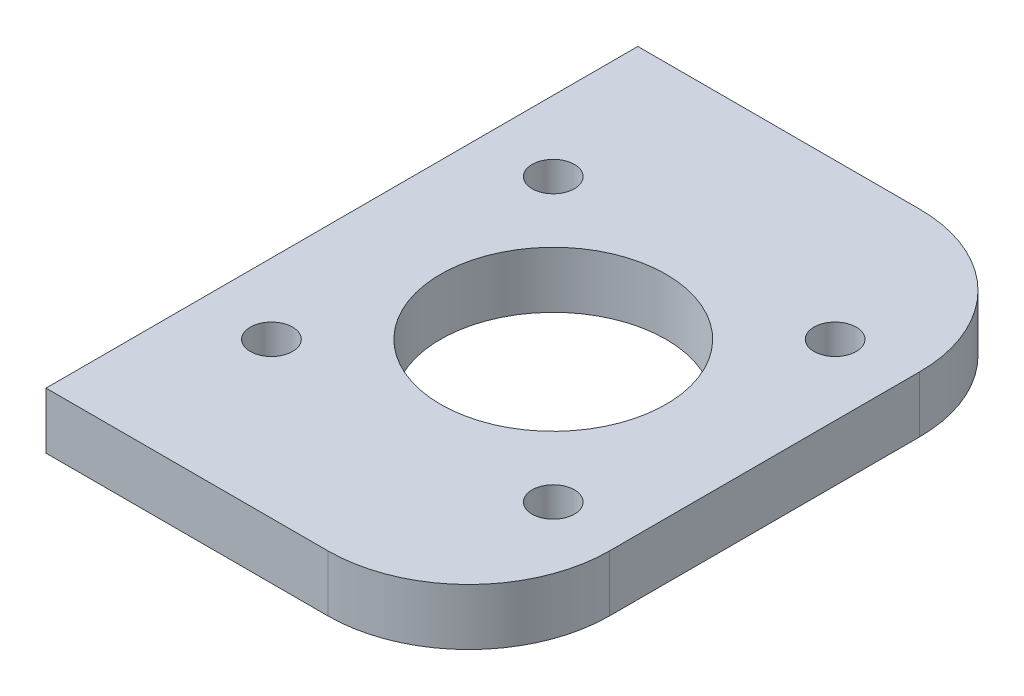
from build123d import *

# Parameters (mm, degrees)
SKETCH2_W           = 30
SKETCH2_H           = 42
SKETCH2_R           = 8
BOSS_EXTRUDE1_DEPTH = 4
FILLET1_R           = 10
SKETCH3_R           = 1.5
CUT_EXTRUDE1_DEPTH  = 6


with BuildPart() as part:
    # Sketch2 → Boss-Extrude1 (new body)
    with BuildSketch(Plane(origin=(0, 0, 0), x_dir=(1, 0, 0), z_dir=(0, 1, 0))):
        Rectangle(SKETCH2_W, SKETCH2_H)
        with Locations(Location((0, 0, 0), (0, 0, 270))):
            Circle(SKETCH2_R, mode=Mode.SUBTRACT)
    extrude(amount=BOSS_EXTRUDE1_DEPTH)

    # Fillet1
    fillet1_edges = [part.edges().sort_by_distance(p)[0] for p in [
        (15, 2, 21),
        (15, 2, -21),
    ]]
    fillet(fillet1_edges, radius=FILLET1_R)

    # Sketch3 → Cut-Extrude1 (cut)
    with BuildSketch(Plane(origin=(0, 4, 0), x_dir=(1, 0, 0), z_dir=(0, 1, 0))):
        with Locations(Location((-10, 10, 0), (0, 0, 270))):
            Circle(SKETCH3_R)
        with Locations(Location((10, 10, 0), (0, 0, 270))):
            Circle(SKETCH3_R)
        with Locations(Location((10, -10, 0), (0, 0, 270))):
            Circle(SKETCH3_R)
        with Locations(Location((-10, -10, 0), (0, 0, 270))):
            Circle(SKETCH3_R)
    extrude(amount=-CUT_EXTRUDE1_DEPTH, mode=Mode.SUBTRACT)


solid = part.part
